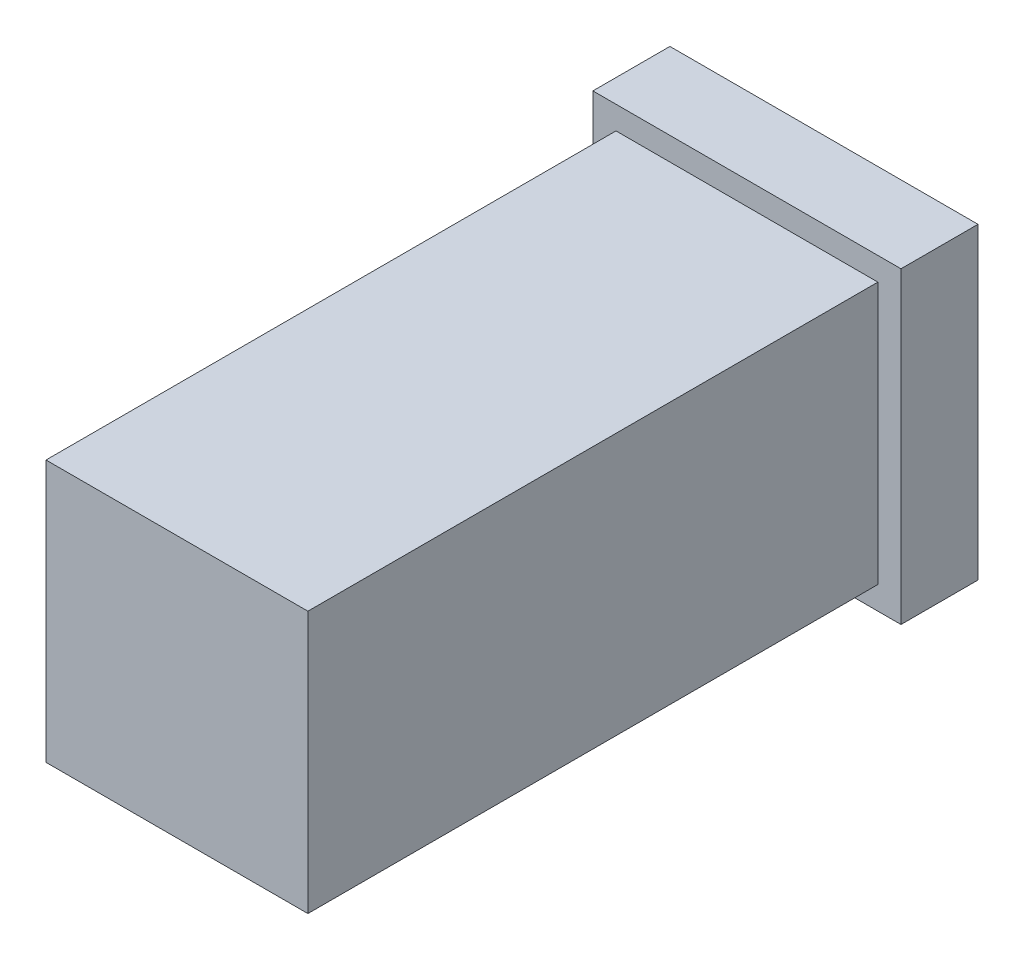
from build123d import *

# Parameters (mm, degrees)
SKETCH_1_W          = 20
SKETCH_1_H          = 20
EXTRUDE_1_DEPTH     = 5
SKETCH_2_W          = 17
SKETCH_2_H          = 17
EXTRUDE_2_DEPTH     = 37
SKETCH_3_R          = 4
CUT_EXTRUDE_1_DEPTH = 10


with BuildPart() as part:
    # ｽｹｯﾁ1 → ﾎﾞｽ - 押し出し1 (new body)
    with BuildSketch(Plane.XY):
        Rectangle(SKETCH_1_W, SKETCH_1_H)
    extrude(amount=EXTRUDE_1_DEPTH)

    # ｽｹｯﾁ2 → ﾎﾞｽ - 押し出し2 (add)
    with BuildSketch(Plane.XY.offset(5)):
        Rectangle(SKETCH_2_W, SKETCH_2_H)
    extrude(amount=EXTRUDE_2_DEPTH)

    # ｽｹｯﾁ3 → ｶｯﾄ - 押し出し1 (cut)
    with BuildSketch(Plane(origin=(0, 0, 0), x_dir=(-1, 0, 0), z_dir=(0, 0, -1))):
        Circle(SKETCH_3_R)
    extrude(amount=-CUT_EXTRUDE_1_DEPTH, mode=Mode.SUBTRACT)


solid = part.part
